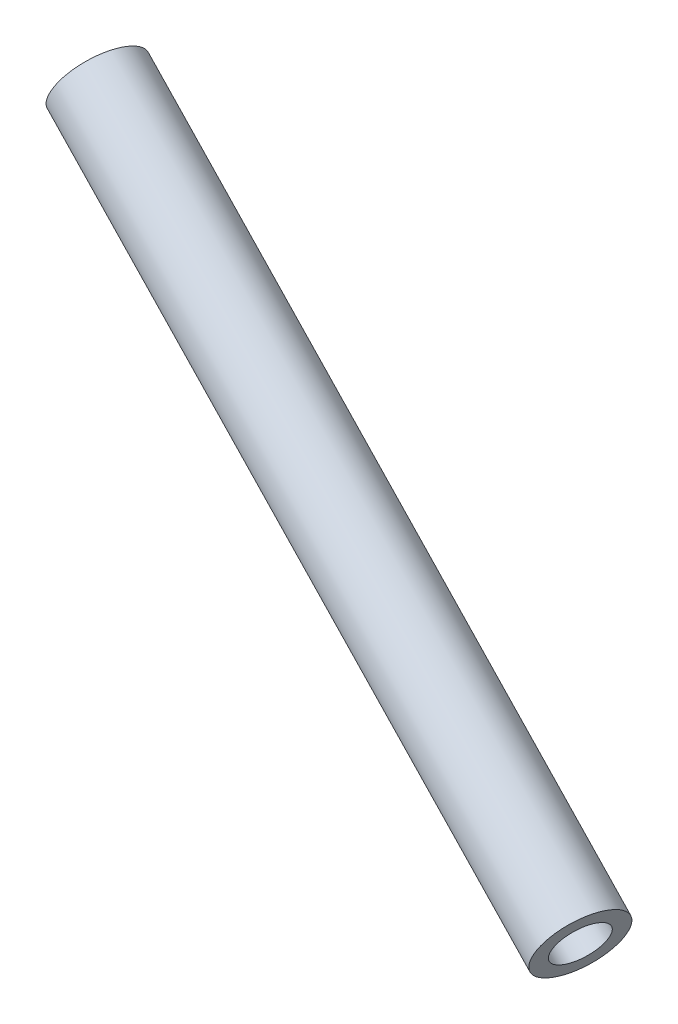
from build123d import *

# Parameters (mm, degrees)
SLIDING_SLEEVE_OUTSIDE_SKETCH_R = 2.5
SLIDING_SLEEVE_OUTSIDE_DEPTH    = 46.364941753
SLIDING_SLEEVE_BORE_SKETCH_R    = 1.55
SLIDING_SLEEVE_BORE_DEPTH       = 46.564941753


with BuildPart() as part:
    # Sliding sleeve outside sketch → Sliding sleeve outside (new body)
    with BuildSketch(Plane(origin=(-55.335742198, -27.677379212, -14.827167434), x_dir=(-0.20842845999452608, -0.1042500434014437, 0.9724656834640014), z_dir=(-0.8697399638531155, -0.43501942576382596, -0.23304612093938112))):
        with Locations(Location((13.090181548, -53.527480937, 0), (0, 0, 270))):
            Circle(SLIDING_SLEEVE_OUTSIDE_SKETCH_R)
    extrude(amount=SLIDING_SLEEVE_OUTSIDE_DEPTH)

    # Sliding sleeve bore sketch → Sliding sleeve bore (cut)
    with BuildSketch(Plane(origin=(-55.248768201, -27.633877269, -14.803862822), x_dir=(-0.20842845999452578, -0.10425004340144366, 0.9724656834640014), z_dir=(-0.8697399638531151, -0.4350194257638266, -0.23304612093938085))):
        with Locations(Location((13.090181548, -53.527480937, 0), (0, 0, 90))):
            Circle(SLIDING_SLEEVE_BORE_SKETCH_R)
    extrude(amount=SLIDING_SLEEVE_BORE_DEPTH, mode=Mode.SUBTRACT)


with BuildPart() as body_2:
    # Mirror1: mirrored copy
    add(part.part.mirror(Plane(origin=(0, 0, 0), x_dir=(0, 0, 1), z_dir=(0, -1, 0))))


solid = body_2.part
